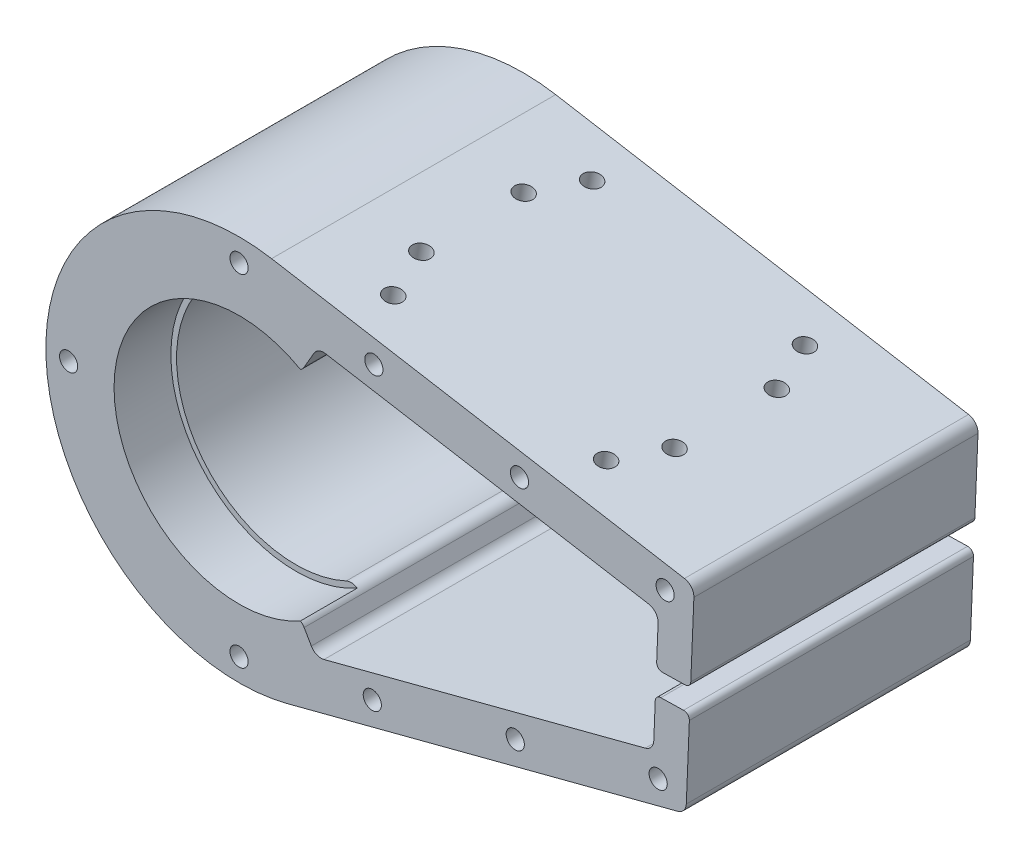
from build123d import *

# Parameters (mm, degrees)
EXTRUDE_1_DEPTH            = 50
SKETCH_2_R                 = 26
CUT_EXTRUDE_1_DEPTH        = 50
EXTRUDE_2_DEPTH            = 50
CUT_EXTRUDE_START          = -68
SKETCH_3_R                 = 1.6
CUT_EXTRUDE_2_DEPTH        = 68
CUT_EXTRUDE_1_2_DEPTH      = 143.467540163
CUT_EXTRUDE_1_2_DEPTH_BACK = 58
CUT_EXTRUDE_START_2        = -58
CUT_EXTRUDE_3_DEPTH        = 58
EXTRUDE_3_DEPTH            = 50
FILLET_1_R                 = 2
SKETCH_8_R                 = 22
CUT_EXTRUDE_4_DEPTH        = 10
SKETCH_9_R                 = 23.5
CUT_EXTRUDE_5_DEPTH        = 6
EXTRUDE_4_DEPTH            = 50
FILLET_2_R                 = 2
SKETCH_11_R                = 1.6
CUT_EXTRUDE_6_DEPTH        = 24
SKETCH_12_R                = 1.6
CUT_EXTRUDE_7_DEPTH        = 10
CUT_EXTRUDE_8_DEPTH        = 72
FILLET_3_R                 = 1


with BuildPart() as part:
    # 草图1 → 凸台-拉伸1 (new body)
    with BuildSketch(Plane.XY):
        with BuildLine():
            Line((-86.410526316, 32.89712665), (2.526315789, 9.675625485))
            ThreePointArc((2.526315789, 9.675625485), (10, 0), (2.526315789, -9.675625485))
            Line((2.526315789, -9.675625485), (-86.410526316, -32.89712665))
            ThreePointArc((-86.410526316, -32.89712665), (-129, 0), (-86.410526316, 32.89712665))
        make_face()
    extrude(amount=EXTRUDE_1_DEPTH)

    # 草图2 → Cut-Extrude 1 (cut)
    with BuildSketch(Plane.XY.offset(50)):
        with Locations((-95, 0)):
            Circle(SKETCH_2_R)
    extrude(amount=-CUT_EXTRUDE_1_DEPTH, mode=Mode.SUBTRACT)

    # 草图4 → 凸台-拉伸2 (add)
    with BuildSketch(Plane.XY.offset(50)):
        Polygon((-89.273684211, 33.514314964), (0, 18.260853628), (0, 0), align=None)
    extrude(amount=-EXTRUDE_2_DEPTH)

    # 草图3 → 切除-拉伸2 (cut)
    with BuildSketch(Plane.XY.offset(50).offset(CUT_EXTRUDE_START)):
        with Locations((-95, 30)):
            Circle(SKETCH_3_R)
        with Locations((-125, 0)):
            Circle(SKETCH_3_R)
        with Locations((-95, -30)):
            Circle(SKETCH_3_R)
        with Locations((-71.551753536, -24.883386101)):
            Circle(SKETCH_3_R)
        with Locations((-71.274432107, 26.380963088)):
            Circle(SKETCH_3_R)
        with Locations((-45.645838312, 22.002015719)):
            Circle(SKETCH_3_R)
        with Locations((-21.238501013, -11.746543996)):
            Circle(SKETCH_3_R)
        with Locations((-20.017244516, 17.623068351)):
            Circle(SKETCH_3_R)
        with Locations((-46.395127275, -18.314965049)):
            Circle(SKETCH_3_R)
        with BuildLine():
            Line((-67.233345602, -19.621745681), (-22.076558694, -7.831262064))
            Line((-22.076558694, -7.831262064), (-21.17859716, 13.763531668))
            Line((-21.17859716, 13.763531668), (-69.025115802, 21.938673408))
            ThreePointArc((-69.025115802, 21.938673408), (-61.031553592, 1.464461893), (-67.233345602, -19.621745681))
        make_face()
    extrude(amount=CUT_EXTRUDE_2_DEPTH, mode=Mode.SUBTRACT)

    # 草图5 → Cut-Extrude 1 2 (cut, two sides: drawn at the far end of the back side and taken through both)
    with BuildSketch(Plane.XY.offset(50).offset(-CUT_EXTRUDE_1_2_DEPTH_BACK)):
        Polygon((-16.353043274, -14.605045601), (-14.880678398, 20.803392951), (25.084784603, 19.141536445), (23.612419728, -16.266902106), align=None)
    extrude(amount=CUT_EXTRUDE_1_2_DEPTH + CUT_EXTRUDE_1_2_DEPTH_BACK, mode=Mode.SUBTRACT)

    # 草图6 → 切除-拉伸3 (cut)
    with BuildSketch(Plane.XY.offset(50).offset(CUT_EXTRUDE_START_2)):
        with BuildLine():
            Line((-90.621052632, 25.628593796), (-69.025115802, 21.938673408))
            ThreePointArc((-69.025115802, 21.938673408), (-61.031553592, 1.464461893), (-67.233345602, -19.621745681))
            Line((-67.233345602, -19.621745681), (-88.431578947, -25.156626262))
            ThreePointArc((-88.431578947, -25.156626262), (-69.024129218, 1.119882624), (-90.621052632, 25.628593796))
        make_face()
    extrude(amount=CUT_EXTRUDE_3_DEPTH, mode=Mode.SUBTRACT)

    # 草图7 → 凸台-拉伸3 (add)
    with BuildSketch(Plane.XY.offset(50)):
        with BuildLine():
            Line((-82, 22.516660498), (-84.5, 18.186533479))
            ThreePointArc((-84.5, 18.186533479), (-116, 0), (-84.5, -18.186533479))
            Line((-84.5, -18.186533479), (-82, -22.516660498))
            ThreePointArc((-82, -22.516660498), (-121, 0), (-82, 22.516660498))
        make_face()
    extrude(amount=-EXTRUDE_3_DEPTH)

    # 圆角1
    fillet_1_edges = [part.edges().sort_by_distance(p)[0] for p in [
        (-14.880678398, 20.803392951, 25),
        (-16.353043274, -14.605045601, 25),
        (-84.5, 18.186533479, 25),
        (-84.5, -18.186533479, 25),
        (-21.17859716, 13.763531668, 25),
        (-22.076558694, -7.831262064, 25),
    ]]
    fillet(fillet_1_edges, radius=FILLET_1_R)

    # 草图8 → 切除-拉伸4 (cut)
    with BuildSketch(Plane.XY.offset(50)):
        with Locations((-95, 0)):
            Circle(SKETCH_8_R)
    extrude(amount=-CUT_EXTRUDE_4_DEPTH, mode=Mode.SUBTRACT)

    # 草图9 → 切除-拉伸5 (cut)
    with BuildSketch(Plane(origin=(0, 0, 0), x_dir=(-1, 0, 0), z_dir=(0, 0, -1))):
        with Locations((95, 0)):
            Circle(SKETCH_9_R)
    extrude(amount=-CUT_EXTRUDE_5_DEPTH, mode=Mode.SUBTRACT)

    # 草图10 → 凸台-拉伸4 (add)
    with BuildSketch(Plane.XY.offset(50)):
        with BuildLine():
            Line((-90.621052632, 25.628593796), (-81.138728268, 24.008426897))
            Line((-81.138728268, 24.008426897), (-82, 22.516660498))
            ThreePointArc((-82, 22.516660498), (-86.172317115, 24.455510931), (-90.621052632, 25.628593796))
        make_face()
        with BuildLine():
            Line((-82, -22.516660498), (-81.518012702, -23.351486987))
            Line((-81.518012702, -23.351486987), (-88.431578947, -25.156626262))
            ThreePointArc((-88.431578947, -25.156626262), (-85.127151858, -24.052585507), (-82, -22.516660498))
        make_face()
    extrude(amount=-EXTRUDE_4_DEPTH)

    # 圆角2
    fillet_2_edges = [part.edges().sort_by_distance(p)[0] for p in [
        (-81.138728268, 24.008426897, 25),
        (-81.518012702, -23.351486987, 25),
    ]]
    fillet(fillet_2_edges, radius=FILLET_2_R)

    # 草图11 → 切除-拉伸6 (cut)
    with BuildSketch(Plane(origin=(3.031578947, 17.742872628, 0), x_dir=(0.9857151459881658, -0.16842105263157892, 0), z_dir=(0.16842105263157894, 0.9857151459881659, 0))):
        with Locations(Location((-37.931515403, -16, 0), (0, 0, 180))):
            Circle(SKETCH_11_R)
        with Locations(Location((-83.131515403, -16, 0), (0, 0, 180))):
            Circle(SKETCH_11_R)
        with Locations(Location((-83.131515403, -34, 0), (0, 0, 180))):
            Circle(SKETCH_11_R)
        with Locations(Location((-37.931515403, -34, 0), (0, 0, 180))):
            Circle(SKETCH_11_R)
    extrude(amount=-CUT_EXTRUDE_6_DEPTH, mode=Mode.SUBTRACT)

    # 草图12 → 切除-拉伸7 (cut)
    with BuildSketch(Plane(origin=(3.031578947, 17.742872628, 0), x_dir=(0.9857151459881658, -0.16842105263157892, 0), z_dir=(0.16842105263157894, 0.9857151459881659, 0))):
        with Locations(Location((-79.531515403, -7.5, 0), (0, 0, 180))):
            Circle(SKETCH_12_R)
        with Locations(Location((-41.531515403, -7.5, 0), (0, 0, 180))):
            Circle(SKETCH_12_R)
        with Locations(Location((-79.531515403, -42.5, 0), (0, 0, 180))):
            Circle(SKETCH_12_R)
        with Locations(Location((-41.531515403, -42.5, 0), (0, 0, 180))):
            Circle(SKETCH_12_R)
    extrude(amount=-CUT_EXTRUDE_7_DEPTH, mode=Mode.SUBTRACT)

    # 草图13 → 切除-拉伸8 (cut)
    with BuildSketch(Plane.XY.offset(50)):
        Polygon((-21.550135764, 4.82851696), (-15.539418673, 4.961555834), (-15.705941936, 0.956890399), (-21.716659027, 0.823851526), align=None)
    extrude(amount=-CUT_EXTRUDE_8_DEPTH, mode=Mode.SUBTRACT)

    # 圆角3
    fillet_3_edges = [part.edges().sort_by_distance(p)[0] for p in [
        (-15.705941936, 0.956890399, 25),
        (-15.539418673, 4.961555834, 25),
        (-21.716659027, 0.823851526, 25),
        (-21.550135764, 4.82851696, 25),
    ]]
    fillet(fillet_3_edges, radius=FILLET_3_R)


solid = part.part
